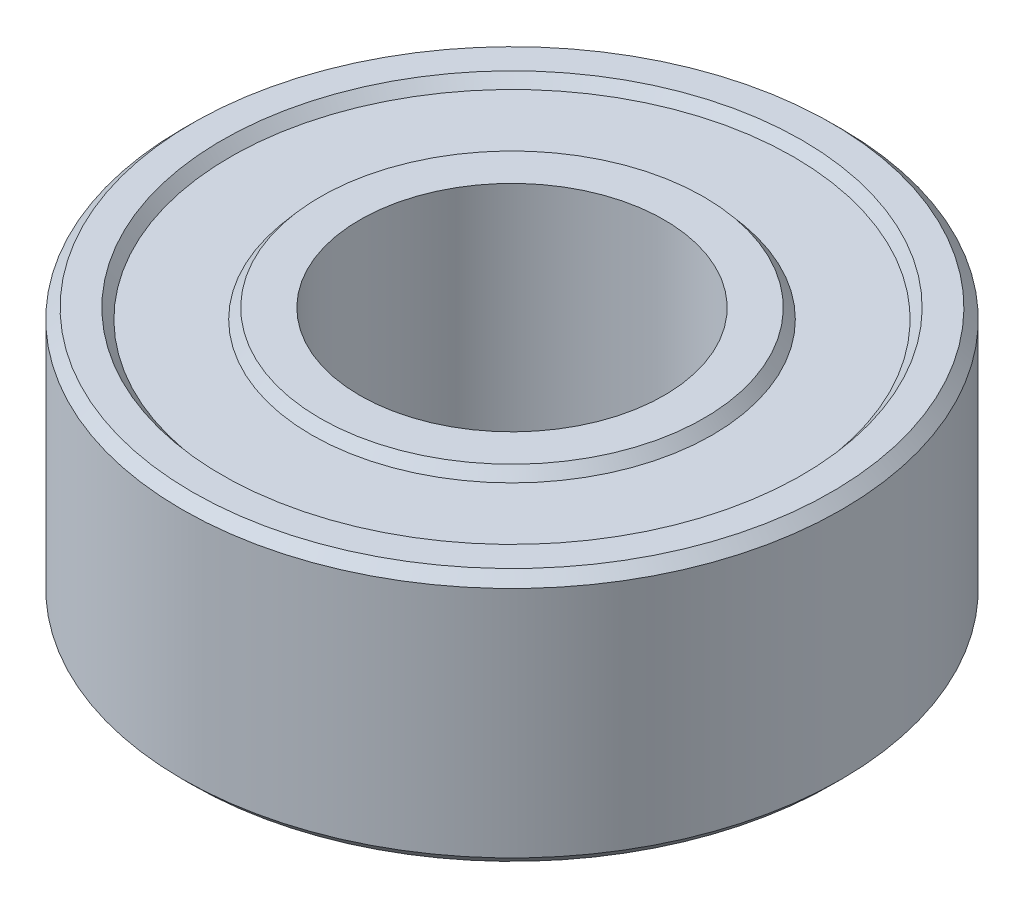
from build123d import *

# Parameters (mm, degrees)
SKETCH_1_R      = 6.5
SKETCH_1_R_2    = 3
EXTRUDE_1_DEPTH = 5
CHAMFER_1_SIZE  = 0.2


with BuildPart() as part:
    # 草图1 → 凸台-拉伸1 (new body)
    with BuildSketch(Plane(origin=(0, 0, 0), x_dir=(1, 0, 0), z_dir=(0, 1, 0))):
        with Locations(Location((0, 0, 0), (0, 0, 270))):
            Circle(SKETCH_1_R)
        with Locations(Location((0, 0, 0), (0, 0, 270))):
            Circle(SKETCH_1_R_2, mode=Mode.SUBTRACT)
    extrude(amount=EXTRUDE_1_DEPTH)

    # 草图2 → 切除-旋转1 (revolve, cut)
    with BuildSketch(Plane(origin=(0, 0, 0), x_dir=(0, 0, -1), z_dir=(1, 0, 0)), mode=Mode.PRIVATE) as cut_revolve_1_sk:
        Polygon((-5.717819926, 5), (-5.55, 4.8), (-3.95, 4.8), (-3.782180074, 5), align=None)
        Polygon((-3.95, 0.2), (-3.782180074, 0), (-5.717819926, 0), (-5.55, 0.2), align=None)
    revolve(cut_revolve_1_sk.sketch.rotate(Axis((0, 0, 0), (0, 1, 0)), 180), axis=Axis((0, 0, 0), (0, 1, 0)), mode=Mode.SUBTRACT)

    # 倒角1
    chamfer_1_edges = [part.edges().sort_by_distance(p)[0] for p in [
        (0, 0, -6.5),
        (0, 5, -6.5),
    ]]
    chamfer(chamfer_1_edges, length=CHAMFER_1_SIZE)


solid = part.part
